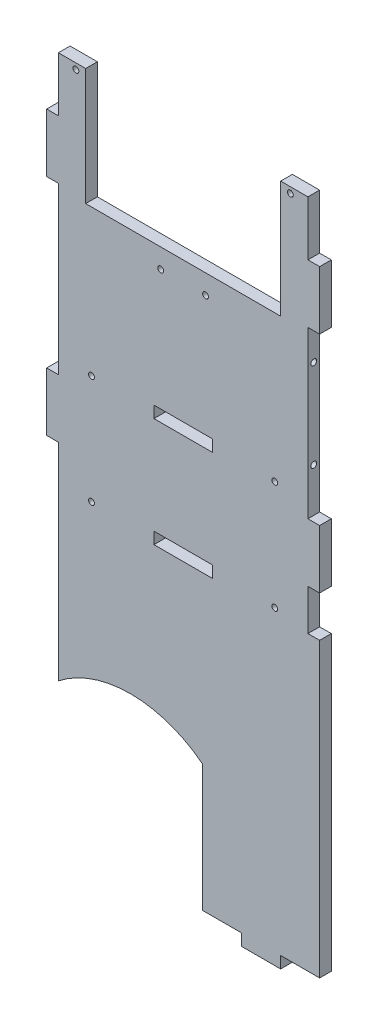
from build123d import *

# Parameters (mm, degrees)
ESQUISSE1_R             = 1.5
ESQUISSE1_W             = 30
ESQUISSE1_H             = 6
BOSS_EXTRU_3_DEPTH      = 6
ESQUISSE4_W             = 6
ESQUISSE4_H             = 28
ESQUISSE4_H_2           = 85
ESQUISSE4_H_3           = 51
ESQUISSE4_H_4           = 21
ENL_V_MAT_EXTRU_2_DEPTH = 6
ESQUISSE5_R             = 1.5
ENL_V_MAT_EXTRU_3_DEPTH = 9
ENL_V_START             = -3
ESQUISSE6_R             = 1.5
ENL_V_MAT_EXTRU_6_DEPTH = 3
ESQUISSE7_W             = 20
ESQUISSE7_H             = 6
ENL_V_MAT_EXTRU_7_DEPTH = 10
ENL_V_MAT_EXTRU_8_DEPTH = 6
ESQUISSE9_R             = 1.5
ESQUISSE9_W             = 30
ESQUISSE9_H             = 6
ENL_V_MAT_EXTRU_9_DEPTH = 6


with BuildPart() as part:
    # Esquisse1 → Boss.-Extru.3 (new body)
    with BuildSketch(Plane.XY):
        Polygon((19.996437878, 165.487179487), (-0.003562122, 165.487179487), (-0.003562122, -184.512820513), (139.996437878, -184.512820513), (139.996437878, 165.487179487), (119.996437878, 165.487179487), (119.996437878, 105.487179487), (19.996437878, 105.487179487), align=None)
        with Locations((22.996437878, -25.512820513)):
            Circle(ESQUISSE1_R, mode=Mode.SUBTRACT)
        with Locations((69.996437878, -25.512820513)):
            Rectangle(ESQUISSE1_W, ESQUISSE1_H, mode=Mode.SUBTRACT)
        with Locations((116.996437878, -25.512820513)):
            Circle(ESQUISSE1_R, mode=Mode.SUBTRACT)
        with Locations((14.996437878, 162.487179487)):
            Circle(ESQUISSE1_R, mode=Mode.SUBTRACT)
        with Locations((58.496437878, 95.487179487)):
            Circle(ESQUISSE1_R, mode=Mode.SUBTRACT)
        with Locations((81.496437878, 95.487179487)):
            Circle(ESQUISSE1_R, mode=Mode.SUBTRACT)
        with Locations((124.996437878, 162.487179487)):
            Circle(ESQUISSE1_R, mode=Mode.SUBTRACT)
    extrude(amount=BOSS_EXTRU_3_DEPTH)

    # Esquisse4 → Enlèv. mat.-Extru.2 (cut)
    with BuildSketch(Plane.XY):
        with Locations((2.996437878, 151.487179487)):
            Rectangle(ESQUISSE4_W, ESQUISSE4_H)
        with Locations((2.996437878, 64.987179487)):
            Rectangle(ESQUISSE4_W, ESQUISSE4_H_2)
        with Locations((2.996437878, -33.012820513)):
            Rectangle(ESQUISSE4_W, ESQUISSE4_H_3)
        with Locations((136.996437878, -18.012820513)):
            Rectangle(ESQUISSE4_W, ESQUISSE4_H_4)
        with Locations((136.996437878, 64.987179487)):
            Rectangle(ESQUISSE4_W, ESQUISSE4_H_2)
        with Locations((136.996437878, 151.487179487)):
            Rectangle(ESQUISSE4_W, ESQUISSE4_H)
    extrude(amount=ENL_V_MAT_EXTRU_2_DEPTH, mode=Mode.SUBTRACT)

    # Esquisse5 → Enlèv. mat.-Extru.3 (cut)
    with BuildSketch(Plane(origin=(0, 0, 0), x_dir=(0, 0, -1), z_dir=(1, 0, 0))):
        with Locations(Location((-3, -30.012820513, 0), (0, 0, 270))):
            Circle(ESQUISSE5_R)
        with Locations((-3, -0.012820513)):
            Circle(ESQUISSE5_R)
        with Locations(Location((-3, 90.487179487, 0), (0, 0, 270))):
            Circle(ESQUISSE5_R)
        with Locations((-3, 120.487179487)):
            Circle(ESQUISSE5_R)
    extrude(amount=ENL_V_MAT_EXTRU_3_DEPTH, mode=Mode.SUBTRACT)

    # Esquisse6 → Enlèv. mat.-Extru.6 (cut)
    with BuildSketch(Plane(origin=(133.996437878, 0, 0), x_dir=(0, 0, -1), z_dir=(1, 0, 0)).offset(ENL_V_START)):
        with Locations(Location((-3, 90.487179487, 0), (0, 0, 270))):
            Circle(ESQUISSE6_R)
        with Locations(Location((-3, 44.987179487, 0), (0, 0, 90))):
            Circle(ESQUISSE6_R)
        with Locations((-3, 120.487179487)):
            Circle(ESQUISSE6_R)
    extrude(amount=ENL_V_MAT_EXTRU_6_DEPTH, mode=Mode.SUBTRACT)

    # Esquisse7 → Enlèv. mat.-Extru.7 (cut)
    with BuildSketch(Plane.XY):
        with Locations((129.996437878, -181.512820513)):
            Rectangle(ESQUISSE7_W, ESQUISSE7_H)
        with Locations((89.996437878, -181.512820513)):
            Rectangle(ESQUISSE7_W, ESQUISSE7_H)
    extrude(amount=ENL_V_MAT_EXTRU_7_DEPTH, mode=Mode.SUBTRACT)

    # Esquisse8 → Enlèv. mat.-Extru.8 (cut)
    with BuildSketch(Plane.XY.offset(6)):
        with BuildLine():
            Line((79.996437878, -178.512820513), (79.996437878, -113.512820513))
            ThreePointArc((79.996437878, -113.512820513), (42.996437878, -100.746283227), (5.996437878, -113.512820513))
            Line((5.996437878, -113.512820513), (5.996437878, -58.512820513))
            Line((5.996437878, -58.512820513), (-0.003562122, -58.512820513))
            Line((-0.003562122, -58.512820513), (-0.003562122, -184.512820513))
            Line((-0.003562122, -184.512820513), (79.996437878, -184.512820513))
            Line((79.996437878, -184.512820513), (79.996437878, -178.512820513))
        make_face()
    extrude(amount=-ENL_V_MAT_EXTRU_8_DEPTH, mode=Mode.SUBTRACT)

    # Esquisse9 → Enlèv. mat.-Extru.9 (cut)
    with BuildSketch(Plane.XY.offset(6)):
        with Locations((116.996437878, 30.487179487)):
            Circle(ESQUISSE9_R)
        with Locations((22.996437878, 30.487179487)):
            Circle(ESQUISSE9_R)
        with Locations((69.996437878, 30.487179487)):
            Rectangle(ESQUISSE9_W, ESQUISSE9_H)
    extrude(amount=-ENL_V_MAT_EXTRU_9_DEPTH, mode=Mode.SUBTRACT)


solid = part.part
